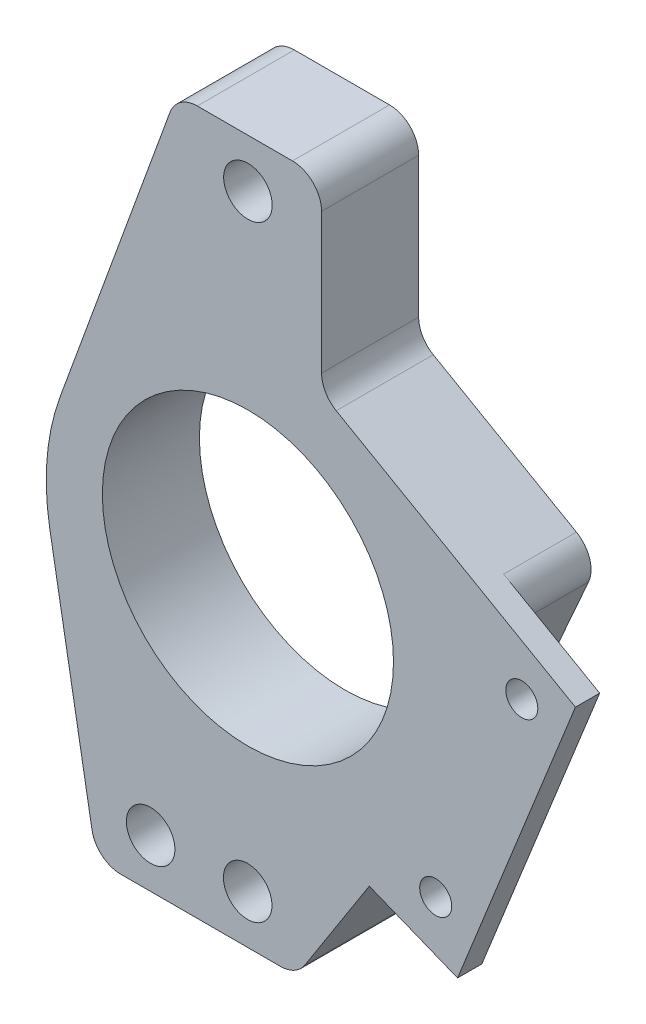
from build123d import *

# Parameters (mm, degrees)
SKETCH1_R           = 38.1
SKETCH1_R_2         = 6.35
BOSS_EXTRUDE1_DEPTH = 25.4
CUT_EXTRUDE1_DEPTH  = 19.05
SKETCH3_R           = 4.191
CUT_EXTRUDE2_DEPTH  = 135.408969451
FILLET1_R           = 7.62


with BuildPart() as part:
    # Sketch1 → Boss-Extrude1 (new body)
    with BuildSketch(Plane.XY):
        with BuildLine():
            Line((-18.576252895, 100.365223368), (19.281255226, 100.365223368))
            Line((19.281255226, 100.365223368), (19.281255226, 51.662487547))
            Line((19.281255226, 51.662487547), (85.717168685, 13.57632424))
            Line((85.717168685, 13.57632424), (54.8677317, -63.233808937))
            Line((54.8677317, -63.233808937), (31.764899533, -53.954963352))
            Line((31.764899533, -53.954963352), (12.667818141, -83.786038719))
            Line((12.667818141, -83.786038719), (-39.703691579, -83.786038719))
            Line((-39.703691579, -83.786038719), (-51.867045524, -14.691351221))
            ThreePointArc((-51.867045524, -14.691351221), (-52.552830667, 1.14672743), (-49.113541671, 16.622073237))
            Line((-49.113541671, 16.622073237), (-18.576252895, 100.365223368))
        make_face()
        Circle(SKETCH1_R, mode=Mode.SUBTRACT)
        with Locations((0, 87.665223368)):
            Circle(SKETCH1_R_2, mode=Mode.SUBTRACT)
        with Locations((-0.06167368, -71.086038719)):
            Circle(SKETCH1_R_2, mode=Mode.SUBTRACT)
        with Locations((-25.46167368, -71.075181752)):
            Circle(SKETCH1_R_2, mode=Mode.SUBTRACT)
    extrude(amount=BOSS_EXTRUDE1_DEPTH)

    # Sketch2 → Cut-Extrude1 (cut)
    with BuildSketch(Plane.XY):
        Polygon((54.8677317, -63.233808937), (31.764899533, -53.954963352), (66.538177491, 24.571193621), (85.717168685, 13.57632424), align=None)
    extrude(amount=CUT_EXTRUDE1_DEPTH, mode=Mode.SUBTRACT)

    # Sketch3 → Cut-Extrude2 (cut, through all)
    with BuildSketch(Plane.XY.offset(25.4)):
        with Locations((71.679164996, 8.361848351)):
            Circle(SKETCH3_R)
        with Locations((49.148937242, -47.734792738)):
            Circle(SKETCH3_R)
    extrude(amount=-CUT_EXTRUDE2_DEPTH, mode=Mode.SUBTRACT)

    # Fillet1
    fillet1_edges = [part.edges().sort_by_distance(p)[0] for p in [
        (12.667818141, -83.786038719, 12.7),
        (-39.703691579, -83.786038719, 12.7),
        (-18.576252895, 100.365223368, 12.7),
        (19.281255226, 100.365223368, 12.7),
        (19.281255226, 51.662487547, 12.7),
        (66.538177491, 24.571193621, 9.525),
    ]]
    fillet(fillet1_edges, radius=FILLET1_R)


solid = part.part
